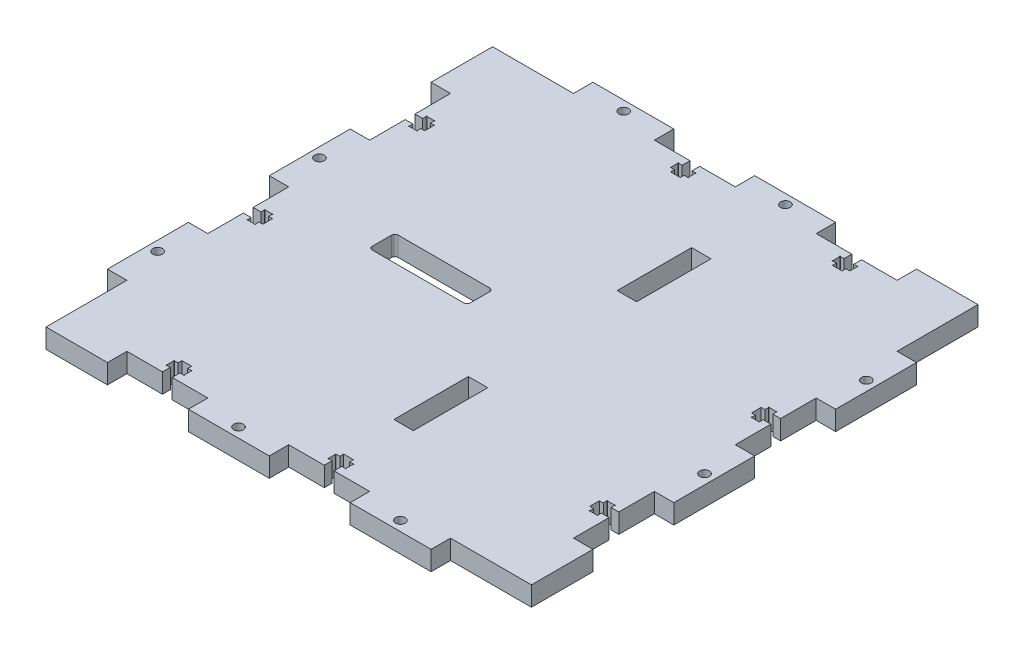
from build123d import *

# Parameters (mm, degrees)
BOSS_EXTRUDE1_DEPTH = 6
SKETCH2_R           = 1.5
CUT_EXTRUDE1_DEPTH  = 107.235587258
SKETCH3_W           = 6
SKETCH3_H           = 23
CUT_EXTRUDE2_DEPTH  = 107.235587258
SKETCH4_W           = 30.3
SKETCH4_H           = 8
CUT_EXTRUDE3_DEPTH  = 107.235587258
FILLET1_R           = 1


with BuildPart() as part:
    # Sketch1 → Boss-Extrude1 (new body)
    with BuildSketch(Plane(origin=(0, 0, 0), x_dir=(1, 0, 0), z_dir=(0, 1, 0))):
        Polygon((0, 75), (25, 75), (25, 69), (50, 69), (50, 75), (69, 75), (69, 50), (75, 50), (75, 25), (69, 25), (69, 0), (75, 0), (75, -25), (69, -25), (69, -50), (75, -50), (75, -69), (50, -69), (50, -75), (25, -75), (25, -69), (0, -69), (0, -75), (-25, -75), (-25, -69), (-50, -69), (-50, -75), (-69, -75), (-69, -50), (-75, -50), (-75, -25), (-69, -25), (-69, 0), (-75, 0), (-75, 25), (-69, 25), (-69, 50), (-75, 50), (-75, 69), (-50, 69), (-50, 75), (-25, 75), (-25, 69), (0, 69), align=None)
    extrude(amount=BOSS_EXTRUDE1_DEPTH)

    # Sketch2 → Cut-Extrude1 (cut, through all)
    with BuildSketch(Plane(origin=(0, 6, 0), x_dir=(1, 0, 0), z_dir=(0, 1, 0))):
        with Locations(Location((-37.5, 72, 0), (0, 0, 270))):
            Circle(SKETCH2_R)
        with Locations(Location((12.5, 72, 0), (0, 0, 270))):
            Circle(SKETCH2_R)
        with Locations(Location((72, 37.5, 0), (0, 0, 270))):
            Circle(SKETCH2_R)
        with Locations(Location((72, -12.5, 0), (0, 0, 270))):
            Circle(SKETCH2_R)
        with Locations(Location((37.5, -72, 0), (0, 0, 270))):
            Circle(SKETCH2_R)
        with Locations(Location((-12.5, -72, 0), (0, 0, 270))):
            Circle(SKETCH2_R)
        with Locations(Location((-72, -37.5, 0), (0, 0, 270))):
            Circle(SKETCH2_R)
        with Locations(Location((-72, 12.5, 0), (0, 0, 270))):
            Circle(SKETCH2_R)
        with BuildLine():
            Line((-11, 69), (-14, 69))
            Line((-14, 69), (-14, 66.6))
            Line((-14, 66.6), (-15.1, 66.6))
            ThreePointArc((-15.1, 66.6), (-15.270710678, 66.670710678), (-15.2, 66.5))
            Line((-15.2, 66.5), (-15.2, 64.3))
            ThreePointArc((-15.2, 64.3), (-15.270710678, 64.129289322), (-15.1, 64.2))
            Line((-15.1, 64.2), (-14, 64.2))
            Line((-14, 64.2), (-14, 63))
            Line((-14, 63), (-11, 63))
            Line((-11, 63), (-11, 64.2))
            Line((-11, 64.2), (-9.9, 64.2))
            ThreePointArc((-9.9, 64.2), (-9.729289322, 64.129289322), (-9.8, 64.3))
            Line((-9.8, 64.3), (-9.8, 66.5))
            ThreePointArc((-9.8, 66.5), (-9.729289322, 66.670710678), (-9.9, 66.6))
            Line((-9.9, 66.6), (-11, 66.6))
            Line((-11, 66.6), (-11, 69))
        make_face()
        with BuildLine():
            Line((69, 11), (69, 14))
            Line((69, 14), (66.6, 14))
            Line((66.6, 14), (66.6, 15.1))
            ThreePointArc((66.6, 15.1), (66.670710678, 15.270710678), (66.5, 15.2))
            Line((66.5, 15.2), (64.3, 15.2))
            ThreePointArc((64.3, 15.2), (64.129289322, 15.270710678), (64.2, 15.1))
            Line((64.2, 15.1), (64.2, 14))
            Line((64.2, 14), (63, 14))
            Line((63, 14), (63, 11))
            Line((63, 11), (64.2, 11))
            Line((64.2, 11), (64.2, 9.9))
            ThreePointArc((64.2, 9.9), (64.129289322, 9.729289322), (64.3, 9.8))
            Line((64.3, 9.8), (66.5, 9.8))
            ThreePointArc((66.5, 9.8), (66.670710678, 9.729289322), (66.6, 9.9))
            Line((66.6, 9.9), (66.6, 11))
            Line((66.6, 11), (69, 11))
        make_face()
        with BuildLine():
            Line((39, 69), (36, 69))
            Line((36, 69), (36, 66.6))
            Line((36, 66.6), (34.9, 66.6))
            ThreePointArc((34.9, 66.6), (34.729289322, 66.670710678), (34.8, 66.5))
            Line((34.8, 66.5), (34.8, 64.3))
            ThreePointArc((34.8, 64.3), (34.729289322, 64.129289322), (34.9, 64.2))
            Line((34.9, 64.2), (36, 64.2))
            Line((36, 64.2), (36, 63))
            Line((36, 63), (39, 63))
            Line((39, 63), (39, 64.2))
            Line((39, 64.2), (40.1, 64.2))
            ThreePointArc((40.1, 64.2), (40.270710678, 64.129289322), (40.2, 64.3))
            Line((40.2, 64.3), (40.2, 66.5))
            ThreePointArc((40.2, 66.5), (40.270710678, 66.670710678), (40.1, 66.6))
            Line((40.1, 66.6), (39, 66.6))
            Line((39, 66.6), (39, 69))
        make_face()
        with BuildLine():
            Line((69, -39), (69, -36))
            Line((69, -36), (66.6, -36))
            Line((66.6, -36), (66.6, -34.9))
            ThreePointArc((66.6, -34.9), (66.670710678, -34.729289322), (66.5, -34.8))
            Line((66.5, -34.8), (64.3, -34.8))
            ThreePointArc((64.3, -34.8), (64.129289322, -34.729289322), (64.2, -34.9))
            Line((64.2, -34.9), (64.2, -36))
            Line((64.2, -36), (63, -36))
            Line((63, -36), (63, -39))
            Line((63, -39), (64.2, -39))
            Line((64.2, -39), (64.2, -40.1))
            ThreePointArc((64.2, -40.1), (64.129289322, -40.270710678), (64.3, -40.2))
            Line((64.3, -40.2), (66.5, -40.2))
            ThreePointArc((66.5, -40.2), (66.670710678, -40.270710678), (66.6, -40.1))
            Line((66.6, -40.1), (66.6, -39))
            Line((66.6, -39), (69, -39))
        make_face()
        with BuildLine():
            Line((11, -69), (14, -69))
            Line((14, -69), (14, -66.6))
            Line((14, -66.6), (15.1, -66.6))
            ThreePointArc((15.1, -66.6), (15.270710678, -66.670710678), (15.2, -66.5))
            Line((15.2, -66.5), (15.2, -64.3))
            ThreePointArc((15.2, -64.3), (15.270710678, -64.129289322), (15.1, -64.2))
            Line((15.1, -64.2), (14, -64.2))
            Line((14, -64.2), (14, -63))
            Line((14, -63), (11, -63))
            Line((11, -63), (11, -64.2))
            Line((11, -64.2), (9.9, -64.2))
            ThreePointArc((9.9, -64.2), (9.729289322, -64.129289322), (9.8, -64.3))
            Line((9.8, -64.3), (9.8, -66.5))
            ThreePointArc((9.8, -66.5), (9.729289322, -66.670710678), (9.9, -66.6))
            Line((9.9, -66.6), (11, -66.6))
            Line((11, -66.6), (11, -69))
        make_face()
        with BuildLine():
            Line((-39, -69), (-36, -69))
            Line((-36, -69), (-36, -66.6))
            Line((-36, -66.6), (-34.9, -66.6))
            ThreePointArc((-34.9, -66.6), (-34.729289322, -66.670710678), (-34.8, -66.5))
            Line((-34.8, -66.5), (-34.8, -64.3))
            ThreePointArc((-34.8, -64.3), (-34.729289322, -64.129289322), (-34.9, -64.2))
            Line((-34.9, -64.2), (-36, -64.2))
            Line((-36, -64.2), (-36, -63))
            Line((-36, -63), (-39, -63))
            Line((-39, -63), (-39, -64.2))
            Line((-39, -64.2), (-40.1, -64.2))
            ThreePointArc((-40.1, -64.2), (-40.270710678, -64.129289322), (-40.2, -64.3))
            Line((-40.2, -64.3), (-40.2, -66.5))
            ThreePointArc((-40.2, -66.5), (-40.270710678, -66.670710678), (-40.1, -66.6))
            Line((-40.1, -66.6), (-39, -66.6))
            Line((-39, -66.6), (-39, -69))
        make_face()
        with BuildLine():
            Line((-69, 39), (-69, 36))
            Line((-69, 36), (-66.6, 36))
            Line((-66.6, 36), (-66.6, 34.9))
            ThreePointArc((-66.6, 34.9), (-66.670710678, 34.729289322), (-66.5, 34.8))
            Line((-66.5, 34.8), (-64.3, 34.8))
            ThreePointArc((-64.3, 34.8), (-64.129289322, 34.729289322), (-64.2, 34.9))
            Line((-64.2, 34.9), (-64.2, 36))
            Line((-64.2, 36), (-63, 36))
            Line((-63, 36), (-63, 39))
            Line((-63, 39), (-64.2, 39))
            Line((-64.2, 39), (-64.2, 40.1))
            ThreePointArc((-64.2, 40.1), (-64.129289322, 40.270710678), (-64.3, 40.2))
            Line((-64.3, 40.2), (-66.5, 40.2))
            ThreePointArc((-66.5, 40.2), (-66.670710678, 40.270710678), (-66.6, 40.1))
            Line((-66.6, 40.1), (-66.6, 39))
            Line((-66.6, 39), (-69, 39))
        make_face()
        with BuildLine():
            Line((-69, -11), (-69, -14))
            Line((-69, -14), (-66.6, -14))
            Line((-66.6, -14), (-66.6, -15.1))
            ThreePointArc((-66.6, -15.1), (-66.670710678, -15.270710678), (-66.5, -15.2))
            Line((-66.5, -15.2), (-64.3, -15.2))
            ThreePointArc((-64.3, -15.2), (-64.129289322, -15.270710678), (-64.2, -15.1))
            Line((-64.2, -15.1), (-64.2, -14))
            Line((-64.2, -14), (-63, -14))
            Line((-63, -14), (-63, -11))
            Line((-63, -11), (-64.2, -11))
            Line((-64.2, -11), (-64.2, -9.9))
            ThreePointArc((-64.2, -9.9), (-64.129289322, -9.729289322), (-64.3, -9.8))
            Line((-64.3, -9.8), (-66.5, -9.8))
            ThreePointArc((-66.5, -9.8), (-66.670710678, -9.729289322), (-66.6, -9.9))
            Line((-66.6, -9.9), (-66.6, -11))
            Line((-66.6, -11), (-69, -11))
        make_face()
    extrude(amount=-CUT_EXTRUDE1_DEPTH, mode=Mode.SUBTRACT)

    # Sketch3 → Cut-Extrude2 (cut, through all)
    with BuildSketch(Plane.XZ):
        with Locations((12.5, 34.5)):
            Rectangle(SKETCH3_W, SKETCH3_H)
        with Locations((12.5, -34.5)):
            Rectangle(SKETCH3_W, SKETCH3_H)
    extrude(amount=-CUT_EXTRUDE2_DEPTH, mode=Mode.SUBTRACT)

    # Sketch4 → Cut-Extrude3 (cut, through all)
    with BuildSketch(Plane.XZ):
        with Locations((-25.05, 0)):
            Rectangle(SKETCH4_W, SKETCH4_H)
    extrude(amount=-CUT_EXTRUDE3_DEPTH, mode=Mode.SUBTRACT)

    # Fillet1
    fillet1_edges = [part.edges().sort_by_distance(p)[0] for p in [
        (-40.2, 3, 4),
        (-9.9, 3, 4),
        (-9.9, 3, -4),
        (-40.2, 3, -4),
    ]]
    fillet(fillet1_edges, radius=FILLET1_R)


solid = part.part
